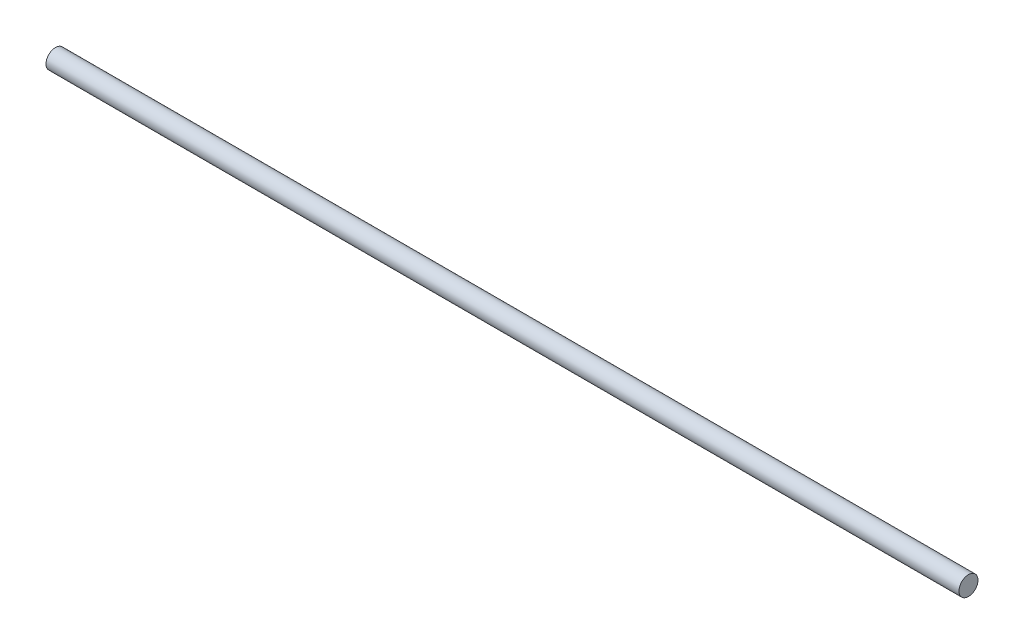
from build123d import *

# Parameters (mm, degrees)
ESQUISSE1_W = 304.8
ESQUISSE1_H = 3.175


with BuildPart() as part:
    # Esquisse1 → Révolution1 (revolve)
    with BuildSketch(Plane.XY, mode=Mode.PRIVATE) as r_volution1_sk:
        with Locations((-152.4, 1.5875)):
            Rectangle(ESQUISSE1_W, ESQUISSE1_H)
    revolve(r_volution1_sk.sketch.rotate(Axis((-304.8, 0, 0), (1, 0, 0)), 270), axis=Axis((-304.8, 0, 0), (1, 0, 0)))


solid = part.part
